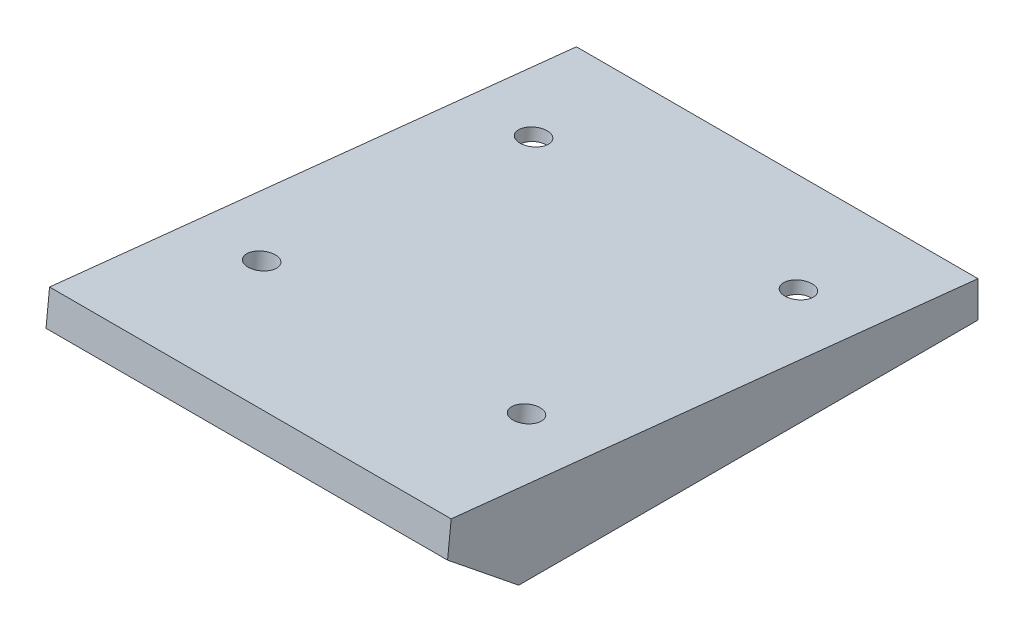
from build123d import *

# Parameters (mm, degrees)
BOSS_EXTRU_1_DEPTH                            = 23.5
BOSS_EXTRU_1_DEPTH_BACK                       = 23.5
ESQUISSE2_W                                   = 45.2
ESQUISSE2_H                                   = 53.75
ENL_V_MAT_EXTRU_1_DEPTH                       = 4.05
ENL_V_MAT_EXTRU_2_REACH                       = 60.542
ESQUISSE3_R                                   = 1.6
TROU_POUR_TARAUDAGE_POUR_TROU_TARAUD_M3_D     = 2.5
TROU_POUR_TARAUDAGE_POUR_TROU_TARAUD_M3_DEPTH = 5
TROU_POUR_TARAUDAGE_POUR_TROU_TARAUD_M3_TIP   = 0.751075774


with BuildPart() as part:
    # Esquisse1 → Boss.-Extru.1 (new, two sides: drawn at the far end of the back side and taken through both)
    with BuildSketch(Plane(origin=(0, 0, 0), x_dir=(0, 0, -1), z_dir=(1, 0, 0)).offset(-BOSS_EXTRU_1_DEPTH_BACK)):
        Polygon((53.75, 4.2), (-7.910357513, 10.680764723), (-8.328471366, 6.702677141), (0, 0), (53.75, 0), align=None)
    extrude(amount=BOSS_EXTRU_1_DEPTH + BOSS_EXTRU_1_DEPTH_BACK)

    # Esquisse2 → Enlèv. mat.-Extru.1 (cut)
    with BuildSketch(Plane.XZ):
        with Locations((0, -26.875)):
            Rectangle(ESQUISSE2_W, ESQUISSE2_H)
    extrude(amount=-ENL_V_MAT_EXTRU_1_DEPTH, mode=Mode.SUBTRACT)

    # Enlèv. mat.-Extru.2: up to this plane
    enl_v_mat_extru_2_end = Plane(origin=(0, 4.05, 0), z_dir=(0, -1, 0))
    # Esquisse3 → Enlèv. mat.-Extru.2 (cut, up to the surface)
    with BuildSketch(Plane(origin=(0, 9.741736652, -1.023897781), x_dir=(1, 0, 0), z_dir=(0, 0.9945218953682741, -0.10452846326764641)), mode=Mode.PRIVATE) as enl_v_mat_extru_2_sk1:
        with Locations(Location((-15.5, 39.929033745, 0), (0, 0, 270))):
            Circle(ESQUISSE3_R)
    enl_v_mat_extru_2_tool1 = split(extrude(enl_v_mat_extru_2_sk1.sketch, amount=-ENL_V_MAT_EXTRU_2_REACH, mode=Mode.PRIVATE), bisect_by=enl_v_mat_extru_2_end, keep=Keep.BOTH, mode=Mode.PRIVATE)
    add(enl_v_mat_extru_2_tool1.solids().sort_by_distance((-15.5, 5.568016, -40.734196))[0], mode=Mode.SUBTRACT)
    # Esquisse3 → Enlèv. mat.-Extru.2 (cut, up to the surface)
    with BuildSketch(Plane(origin=(0, 9.741736652, -1.023897781), x_dir=(1, 0, 0), z_dir=(0, 0.9945218953682741, -0.10452846326764641)), mode=Mode.PRIVATE) as enl_v_mat_extru_2_sk2:
        with Locations(Location((15.5, 39.929033745, 0), (0, 0, 270))):
            Circle(ESQUISSE3_R)
    enl_v_mat_extru_2_tool2 = split(extrude(enl_v_mat_extru_2_sk2.sketch, amount=-ENL_V_MAT_EXTRU_2_REACH, mode=Mode.PRIVATE), bisect_by=enl_v_mat_extru_2_end, keep=Keep.BOTH, mode=Mode.PRIVATE)
    add(enl_v_mat_extru_2_tool2.solids().sort_by_distance((15.5, 5.568016, -40.734196))[0], mode=Mode.SUBTRACT)
    # Esquisse3 → Enlèv. mat.-Extru.2 (cut, up to the surface)
    with BuildSketch(Plane(origin=(0, 9.741736652, -1.023897781), x_dir=(1, 0, 0), z_dir=(0, 0.9945218953682741, -0.10452846326764641)), mode=Mode.PRIVATE) as enl_v_mat_extru_2_sk3:
        with Locations(Location((15.5, 7.929033745, 0), (0, 0, 270))):
            Circle(ESQUISSE3_R)
    enl_v_mat_extru_2_tool3 = split(extrude(enl_v_mat_extru_2_sk3.sketch, amount=-ENL_V_MAT_EXTRU_2_REACH, mode=Mode.PRIVATE), bisect_by=enl_v_mat_extru_2_end, keep=Keep.BOTH, mode=Mode.PRIVATE)
    add(enl_v_mat_extru_2_tool3.solids().sort_by_distance((15.5, 8.912927, -8.909495))[0], mode=Mode.SUBTRACT)
    # Esquisse3 → Enlèv. mat.-Extru.2 (cut, up to the surface)
    with BuildSketch(Plane(origin=(0, 9.741736652, -1.023897781), x_dir=(1, 0, 0), z_dir=(0, 0.9945218953682741, -0.10452846326764641)), mode=Mode.PRIVATE) as enl_v_mat_extru_2_sk4:
        with Locations(Location((-15.5, 7.929033745, 0), (0, 0, 270))):
            Circle(ESQUISSE3_R)
    enl_v_mat_extru_2_tool4 = split(extrude(enl_v_mat_extru_2_sk4.sketch, amount=-ENL_V_MAT_EXTRU_2_REACH, mode=Mode.PRIVATE), bisect_by=enl_v_mat_extru_2_end, keep=Keep.BOTH, mode=Mode.PRIVATE)
    add(enl_v_mat_extru_2_tool4.solids().sort_by_distance((-15.5, 8.912927, -8.909495))[0], mode=Mode.SUBTRACT)

    # Trou pour taraudage pour trou taraudé M31
    with Locations(Plane(origin=(0, 0, 0), x_dir=(-1, 0, 0), z_dir=(0, -0.779044883952261, 0.6269681561194383))):
        with Locations((13.5, -5.548250916), (-13.5, -5.548250916)):
            Hole(TROU_POUR_TARAUDAGE_POUR_TROU_TARAUD_M3_D / 2, depth=TROU_POUR_TARAUDAGE_POUR_TROU_TARAUD_M3_DEPTH)
            with Locations((0, 0, -(TROU_POUR_TARAUDAGE_POUR_TROU_TARAUD_M3_DEPTH + TROU_POUR_TARAUDAGE_POUR_TROU_TARAUD_M3_TIP / 2))):  # 118° drill point
                Cone(0, TROU_POUR_TARAUDAGE_POUR_TROU_TARAUD_M3_D / 2, TROU_POUR_TARAUDAGE_POUR_TROU_TARAUD_M3_TIP, mode=Mode.SUBTRACT)


solid = part.part
